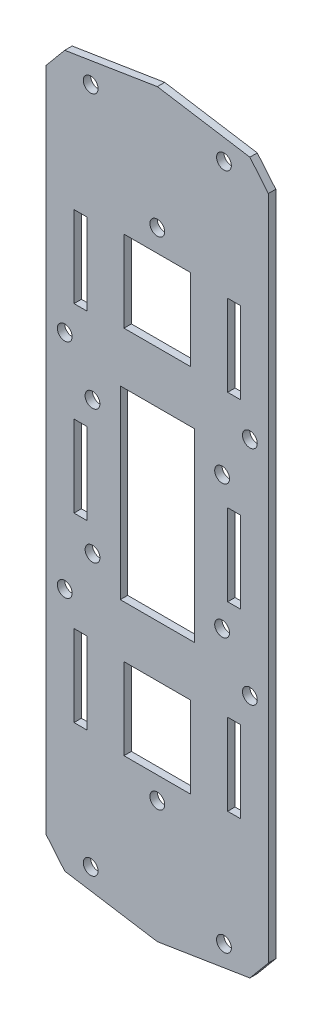
from build123d import *

# Parameters (mm, degrees)
SKETCH1_R           = 2
SKETCH1_W           = 20
SKETCH1_H           = 50
SKETCH1_W_2         = 3.5
SKETCH1_H_2         = 22
SKETCH1_W_3         = 18
BOSS_EXTRUDE1_DEPTH = 2


with BuildPart() as part:
    # Sketch1 → Boss-Extrude1 (new body)
    with BuildSketch(Plane.XY):
        Polygon((0, -100), (-25, -96), (-30, -90), (-30, 90), (-25, 96), (0, 100), (25, 96), (30, 90), (30, -90), (25, -96), align=None)
        with Locations((-18, -91.5)):
            Circle(SKETCH1_R, mode=Mode.SUBTRACT)
        with Locations((-25, -30)):
            Circle(SKETCH1_R, mode=Mode.SUBTRACT)
        with Locations((-17.5, -18)):
            Circle(SKETCH1_R, mode=Mode.SUBTRACT)
        with Locations((0, -67)):
            Circle(SKETCH1_R, mode=Mode.SUBTRACT)
        with Locations((17.5, -18)):
            Circle(SKETCH1_R, mode=Mode.SUBTRACT)
        with Locations((25, -30)):
            Circle(SKETCH1_R, mode=Mode.SUBTRACT)
        with Locations((18, -91.5)):
            Circle(SKETCH1_R, mode=Mode.SUBTRACT)
        with Locations((18, 91.5)):
            Circle(SKETCH1_R, mode=Mode.SUBTRACT)
        with Locations((25, 30)):
            Circle(SKETCH1_R, mode=Mode.SUBTRACT)
        with Locations((17.5, 18)):
            Circle(SKETCH1_R, mode=Mode.SUBTRACT)
        with Locations((0, 67)):
            Circle(SKETCH1_R, mode=Mode.SUBTRACT)
        with Locations((-17.5, 18)):
            Circle(SKETCH1_R, mode=Mode.SUBTRACT)
        with Locations((-25, 30)):
            Circle(SKETCH1_R, mode=Mode.SUBTRACT)
        with Locations((-18, 91.5)):
            Circle(SKETCH1_R, mode=Mode.SUBTRACT)
        Rectangle(SKETCH1_W, SKETCH1_H, mode=Mode.SUBTRACT)
        with Locations((-20.75, -49)):
            Rectangle(SKETCH1_W_2, SKETCH1_H_2, mode=Mode.SUBTRACT)
        with Locations((0, -50)):
            Rectangle(SKETCH1_W_3, SKETCH1_H_2, mode=Mode.SUBTRACT)
        with Locations((-20.75, 0)):
            Rectangle(SKETCH1_W_2, SKETCH1_H_2, mode=Mode.SUBTRACT)
        with Locations((20.75, 0)):
            Rectangle(SKETCH1_W_2, SKETCH1_H_2, mode=Mode.SUBTRACT)
        with Locations((20.75, -49)):
            Rectangle(SKETCH1_W_2, SKETCH1_H_2, mode=Mode.SUBTRACT)
        with Locations((20.75, 49)):
            Rectangle(SKETCH1_W_2, SKETCH1_H_2, mode=Mode.SUBTRACT)
        with Locations((0, 50)):
            Rectangle(SKETCH1_W_3, SKETCH1_H_2, mode=Mode.SUBTRACT)
        with Locations((-20.75, 49)):
            Rectangle(SKETCH1_W_2, SKETCH1_H_2, mode=Mode.SUBTRACT)
    extrude(amount=BOSS_EXTRUDE1_DEPTH)


solid = part.part
